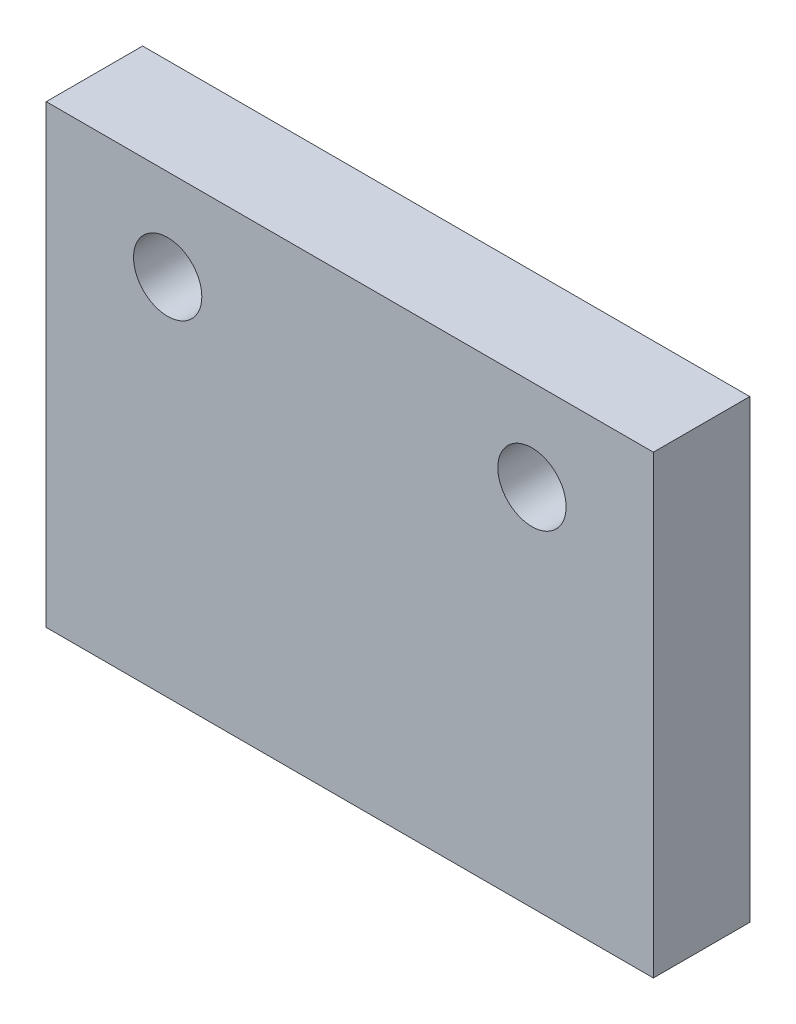
from build123d import *

# Parameters (mm, degrees)
SKETCH1_W           = 40
SKETCH1_H           = 30
SKETCH1_R           = 2.25
BOSS_EXTRUDE1_DEPTH = 6.35


with BuildPart() as part:
    # Sketch1 → Boss-Extrude1 (new body)
    with BuildSketch(Plane.XY):
        Rectangle(SKETCH1_W, SKETCH1_H)
        with Locations((-12, 9)):
            Circle(SKETCH1_R, mode=Mode.SUBTRACT)
        with Locations((12, 9)):
            Circle(SKETCH1_R, mode=Mode.SUBTRACT)
    extrude(amount=BOSS_EXTRUDE1_DEPTH)


solid = part.part
